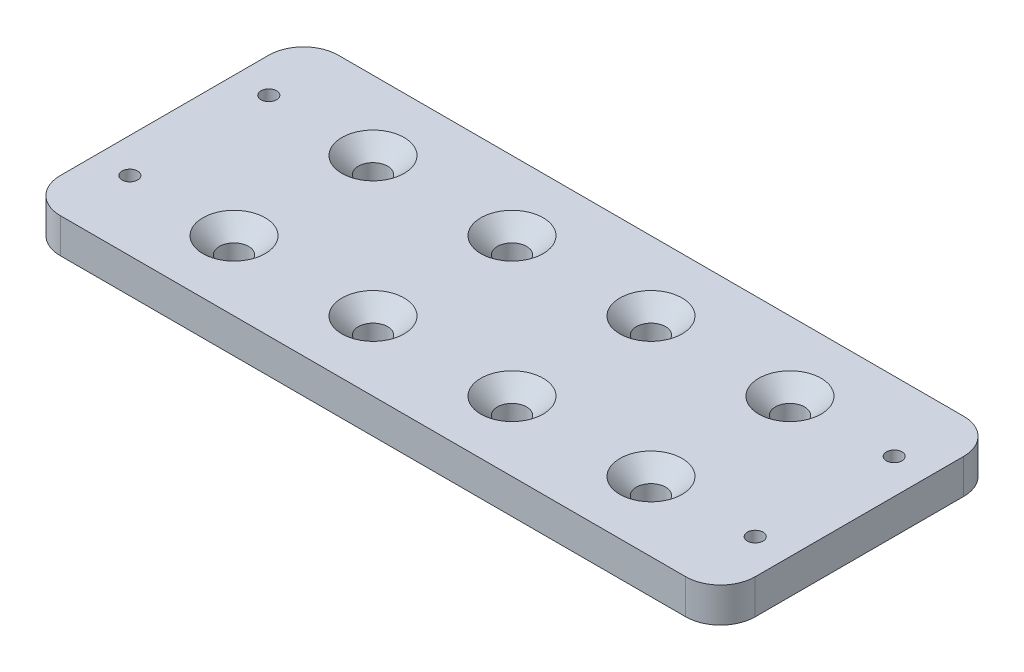
from build123d import *

# Parameters (mm, degrees)
SKETCH1_W                     = 200
SKETCH1_H                     = 80
BOSS_EXTRUDE1_DEPTH           = 10
CSK_FOR_M8_SFHCS1_D           = 8.4
CSK_FOR_M8_SFHCS1_CSINK_D     = 17.92
CSK_FOR_M8_SFHCS1_CSINK_ANGLE = 90
M4_CLEARANCE_HOLE1_D          = 4.5
FILLET1_R                     = 10


with BuildPart() as part:
    # Sketch1 → Boss-Extrude1 (new body)
    with BuildSketch(Plane(origin=(0, 0, 0), x_dir=(1, 0, 0), z_dir=(0, 1, 0))):
        Rectangle(SKETCH1_W, SKETCH1_H)
    extrude(amount=BOSS_EXTRUDE1_DEPTH)

    # CSK for M8 SFHCS1 (through all)
    with Locations(Plane(origin=(0, 10, 0), x_dir=(1, 0, 0), z_dir=(0, 1, 0))):
        with Locations((-20, 20), (20, -20), (60, -20), (-20, -20), (-60, -20), (60, 20), (20, 20), (-60, 20)):
            CounterSinkHole(CSK_FOR_M8_SFHCS1_D / 2, CSK_FOR_M8_SFHCS1_CSINK_D / 2, counter_sink_angle=CSK_FOR_M8_SFHCS1_CSINK_ANGLE)

    # M4 Clearance Hole1 (through all)
    with Locations(Plane(origin=(0, 10, 0), x_dir=(1, 0, 0), z_dir=(0, 1, 0))):
        with Locations((-90, 20), (90, 20), (90, -20), (-90, -20)):
            Hole(M4_CLEARANCE_HOLE1_D / 2)

    # Fillet1
    fillet1_edges = [part.edges().sort_by_distance(p)[0] for p in [
        (100, 5, 40),
        (-100, 5, 40),
        (-100, 5, -40),
        (100, 5, -40),
    ]]
    fillet(fillet1_edges, radius=FILLET1_R)


solid = part.part
